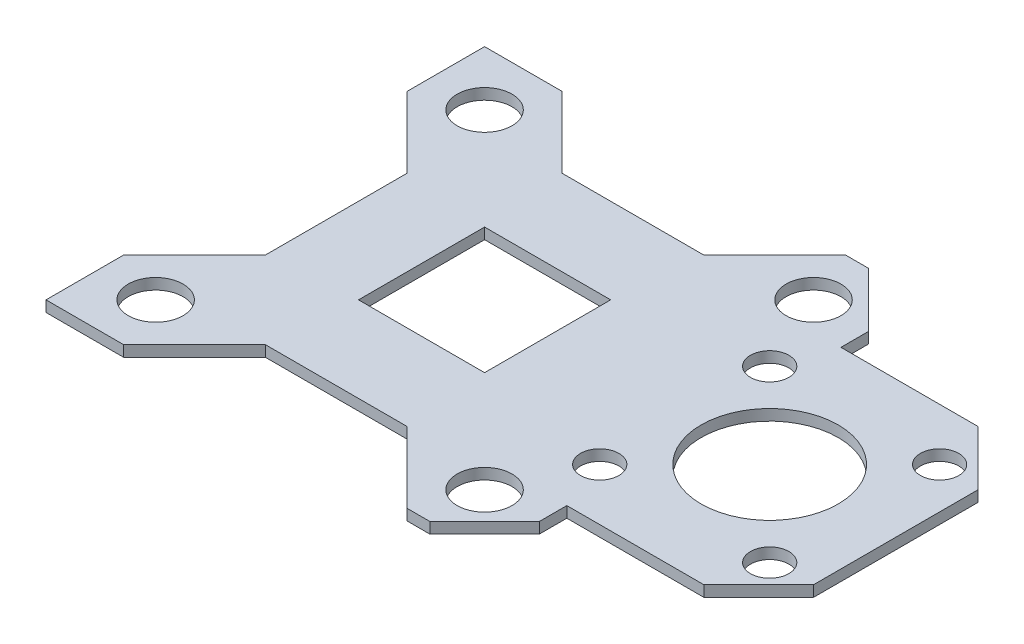
from build123d import *

# Parameters (mm, degrees)
SKETCH1_W           = 80
SKETCH1_H           = 80
BOSS_EXTRUDE1_DEPTH = 2
SKETCH2_R           = 2.5
CUT_EXTRUDE1_DEPTH  = 10
SKETCH4_W           = 80
SKETCH4_H           = 2
BOSS_EXTRUDE2_DEPTH = 35
SKETCH3_R           = 1.5
SKETCH3_R_2         = 12.5
CUT_EXTRUDE2_DEPTH  = 10
SKETCH5_W           = 23
SKETCH5_H           = 23
CUT_EXTRUDE3_DEPTH  = 10
SKETCH6_W           = 35
SKETCH6_H           = 15
CUT_EXTRUDE4_DEPTH  = 10
CHAMFER1_SIZE       = 10
SKETCH7_R           = 5
CUT_EXTRUDE5_DEPTH  = 4
SKETCH8_R           = 3.5
CUT_EXTRUDE6_DEPTH  = 3


with BuildPart() as part:
    # Sketch1 → Boss-Extrude1 (new body)
    with BuildSketch(Plane(origin=(0, 0, 0), x_dir=(1, 0, 0), z_dir=(0, 1, 0))):
        with Locations((40, 40)):
            Rectangle(SKETCH1_W, SKETCH1_H)
    extrude(amount=BOSS_EXTRUDE1_DEPTH)

    # Sketch2 → Cut-Extrude1 (cut)
    with BuildSketch(Plane.XZ):
        with Locations(Location((70, -70, 0), (0, 0, 270))):
            Circle(SKETCH2_R)
        with Locations(Location((70, -10, 0), (0, 0, 270))):
            Circle(SKETCH2_R)
        with Locations(Location((10, -10, 0), (0, 0, 270))):
            Circle(SKETCH2_R)
        with Locations(Location((10, -70, 0), (0, 0, 270))):
            Circle(SKETCH2_R)
    extrude(amount=-CUT_EXTRUDE1_DEPTH, mode=Mode.SUBTRACT)

    # Sketch4 → Boss-Extrude2 (add)
    with BuildSketch(Plane(origin=(80, 0, 0), x_dir=(0, 0, -1), z_dir=(1, 0, 0))):
        with Locations((40, 1)):
            Rectangle(SKETCH4_W, SKETCH4_H)
    extrude(amount=BOSS_EXTRUDE2_DEPTH)

    # Sketch3 → Cut-Extrude2 (cut)
    with BuildSketch(Plane.XZ):
        with Locations(Location((107.5, -24.5, 0), (0, 0, 270))):
            Circle(SKETCH3_R)
        with Locations(Location((107.5, -55.5, 0), (0, 0, 270))):
            Circle(SKETCH3_R)
        with Locations(Location((76.5, -55.5, 0), (0, 0, 270))):
            Circle(SKETCH3_R)
        with Locations(Location((76.5, -24.5, 0), (0, 0, 270))):
            Circle(SKETCH3_R)
        with Locations(Location((92, -40, 0), (0, 0, 270))):
            Circle(SKETCH3_R_2)
    extrude(amount=-CUT_EXTRUDE2_DEPTH, mode=Mode.SUBTRACT)

    # Sketch5 → Cut-Extrude3 (cut)
    with BuildSketch(Plane(origin=(0, 2, 0), x_dir=(1, 0, 0), z_dir=(0, 1, 0))):
        Polygon((65.857864376, 80), (14.142135624, 80), (27.071067812, 67.071067812), (52.928932188, 67.071067812), align=None)
        with Locations((40, 40)):
            Rectangle(SKETCH5_W, SKETCH5_H)
        Polygon((27.071067812, 12.928932188), (14.142135624, 0), (65.857864376, 0), (52.928932188, 12.928932188), align=None)
        Polygon((12.928932188, 52.928932188), (0, 65.857864376), (0, 14.142135624), (12.928932188, 27.071067812), align=None)
    extrude(amount=-CUT_EXTRUDE3_DEPTH, mode=Mode.SUBTRACT)

    # Sketch6 → Cut-Extrude4 (cut)
    with BuildSketch(Plane(origin=(0, 2, 0), x_dir=(1, 0, 0), z_dir=(0, 1, 0))):
        with Locations((97.5, 72.5)):
            Rectangle(SKETCH6_W, SKETCH6_H)
        with Locations((97.5, 7.5)):
            Rectangle(SKETCH6_W, SKETCH6_H)
    extrude(amount=-CUT_EXTRUDE4_DEPTH, mode=Mode.SUBTRACT)

    # Chamfer1
    chamfer1_edges = [part.edges().sort_by_distance(p)[0] for p in [
        (115, 1, -15),
        (115, 1, -65),
        (80, 1, -80),
        (80, 1, 0),
    ]]
    chamfer(chamfer1_edges, length=CHAMFER1_SIZE)

    # Sketch7 → Cut-Extrude5 (cut)
    with BuildSketch(Plane(origin=(0, 2, 0), x_dir=(1, 0, 0), z_dir=(0, 1, 0))):
        with Locations(Location((70, 70, 0), (0, 0, 270))):
            Circle(SKETCH7_R)
        with Locations(Location((70, 10, 0), (0, 0, 270))):
            Circle(SKETCH7_R)
        with Locations(Location((10, 10, 0), (0, 0, 270))):
            Circle(SKETCH7_R)
        with Locations(Location((10, 70, 0), (0, 0, 270))):
            Circle(SKETCH7_R)
    extrude(amount=-CUT_EXTRUDE5_DEPTH, mode=Mode.SUBTRACT)

    # Sketch8 → Cut-Extrude6 (cut)
    with BuildSketch(Plane.XZ):
        with Locations(Location((107.5, -24.5, 0), (0, 0, 270))):
            Circle(SKETCH8_R)
        with Locations(Location((107.5, -55.5, 0), (0, 0, 270))):
            Circle(SKETCH8_R)
        with Locations(Location((76.5, -55.5, 0), (0, 0, 270))):
            Circle(SKETCH8_R)
        with Locations(Location((76.5, -24.5, 0), (0, 0, 270))):
            Circle(SKETCH8_R)
    extrude(amount=-CUT_EXTRUDE6_DEPTH, mode=Mode.SUBTRACT)


solid = part.part
